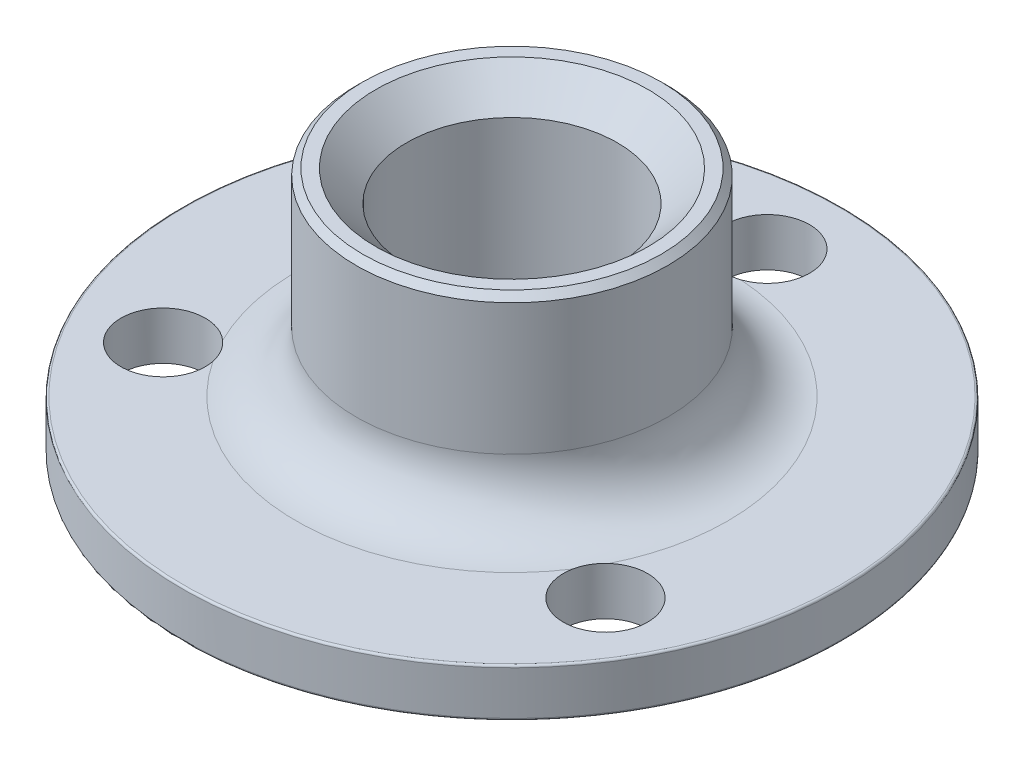
from build123d import *

# Parameters (mm, degrees)
CUT_EXTRUDE1_DEPTH      = 24.217586921
CUT_EXTRUDE1_DEPTH_BACK = 24.217586921
SKETCH4_R               = 2.032
FILLET1_R               = 0.09921875
CHAMFER1_SIZE           = 0.314729983


with BuildPart() as part:
    # Sketch3 → Revolve1 (revolve)
    with BuildSketch(Plane.XY):
        with BuildLine():
            Line((-5.080939697, -3.02895), (-5.080939697, 4.437629646))
            Line((-5.080939697, 4.437629646), (-6.561510051, 5.9182))
            Line((-6.561510051, 5.9182), (-7.5057, 5.9182))
            Line((-7.5057, 5.9182), (-7.5057, -0.71755))
            ThreePointArc((-7.5057, -0.71755), (-8.351941732, -2.760558268), (-10.39495, -3.6068))
            Line((-10.39495, -3.6068), (-15.875, -3.6068))
            Line((-15.875, -3.6068), (-15.875, -5.9182))
            Line((-15.875, -5.9182), (-7.970189697, -5.9182))
            ThreePointArc((-7.970189697, -5.9182), (-5.927181429, -5.071958268), (-5.080939697, -3.02895))
        make_face()
    revolve(axis=Axis((0, -5.9182, 0), (0, 1, 0)))

    # Sketch4 → Cut-Extrude1 (cut, two sides: drawn at the far end of the back side and taken through both)
    with BuildSketch(Plane(origin=(0, 0, 0), x_dir=(1, 0, 0), z_dir=(0, 1, 0)).offset(-CUT_EXTRUDE1_DEPTH_BACK)):
        with Locations((0, 12.303125)):
            Circle(SKETCH4_R)
        with Locations((10.654818796, -6.1515625)):
            Circle(SKETCH4_R)
        with Locations((-10.654818796, -6.1515625)):
            Circle(SKETCH4_R)
    extrude(amount=CUT_EXTRUDE1_DEPTH + CUT_EXTRUDE1_DEPTH_BACK, mode=Mode.SUBTRACT)

    # Fillet1
    fillet1_edges = [part.edges().sort_by_distance(p)[0] for p in [
        (15.875, -3.6068, 0),
        (15.875, -5.9182, 0),
    ]]
    fillet(fillet1_edges, radius=FILLET1_R)

    # Chamfer1
    chamfer1_edges = [part.edges().sort_by_distance(p)[0] for p in [
        (7.5057, 5.9182, 0),
    ]]
    chamfer(chamfer1_edges, length=CHAMFER1_SIZE)


solid = part.part
